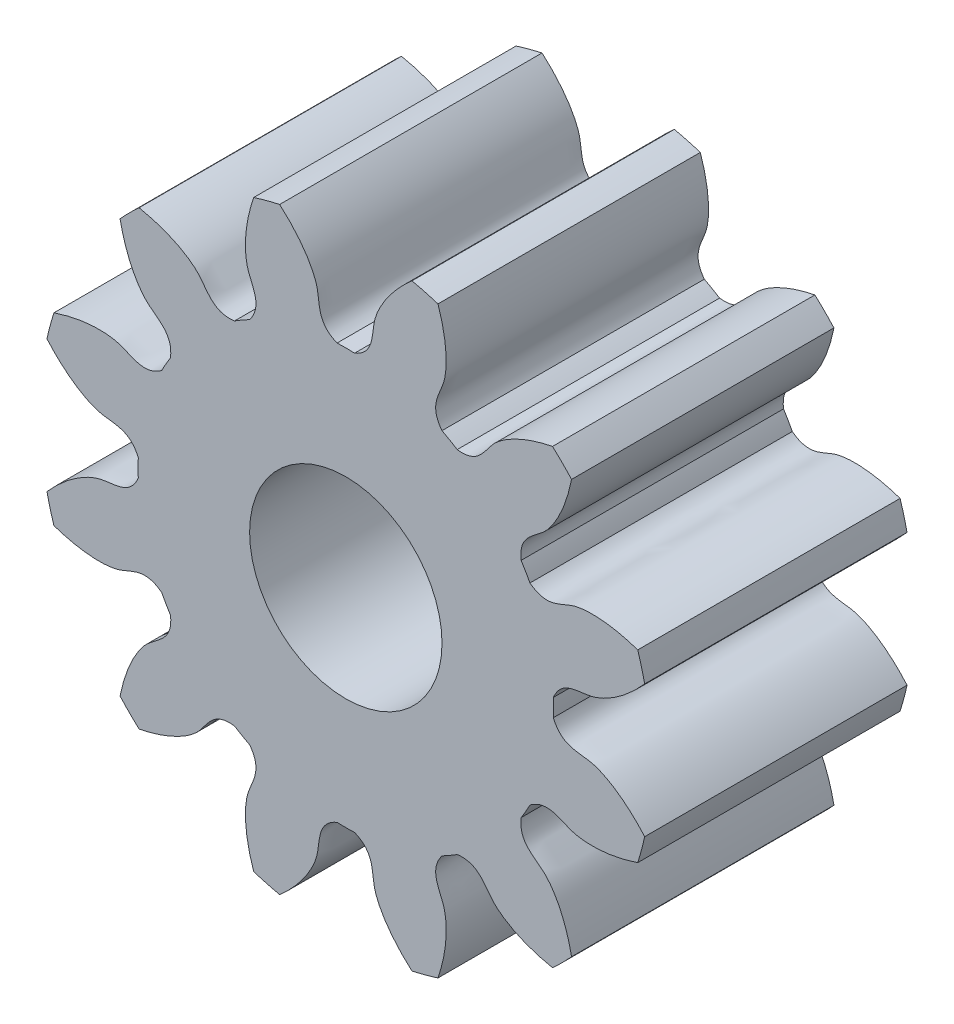
from build123d import *

# Parameters (mm, degrees)
SKETCH_1_R               = 3.5
EXTRUDE_1_DEPTH          = 3
CUT_EXTRUDE_1_DEPTH      = 6.787918451
PATTERN_CIRCULAR_1_COUNT = 12
CUT_EXTRUDE_2_REACH      = 7.688
SKETCH_4_R               = 1.1


with BuildPart() as part:
    # 草图1 → 凸台-拉伸1 (new body)
    with BuildSketch(Plane.XY):
        Circle(SKETCH_1_R)
    extrude(amount=EXTRUDE_1_DEPTH)

    # 草图2 → 切除-拉伸1 (cut, through all)
    with BuildSketch(Plane.XY):
        with BuildLine():
            ThreePointArc((0.100420056, 2.372876063), (0, 2.375), (-0.100420056, 2.372876063))
            add(Edge.make_bspline(
                [(-0.100420056, 2.372876063), (-0.340394435, 2.474653731), (-0.287186739, 2.672409341), (-0.338076094, 2.844740289), (-0.341311927, 2.854952869), (-0.345113625, 2.866166713), (-0.349521434, 2.878363044), (-0.354576313, 2.891521619), (-0.360318258, 2.905621034), (-0.36678678, 2.920638648), (-0.374020716, 2.936550626), (-0.382058239, 2.95333195), (-0.390936819, 2.970956436), (-0.400693193, 2.989396753), (-0.411363332, 3.008624444), (-0.422982412, 3.02860994), (-0.435584786, 3.049322589), (-0.449203949, 3.07073067), (-0.463872517, 3.092801417), (-0.479622192, 3.115501045), (-0.496483738, 3.138794769), (-0.514486952, 3.162646832), (-0.533660639, 3.187020528), (-0.554032585, 3.211878226), (-0.575629533, 3.237181399), (-0.598477155, 3.262890651), (-0.622600033, 3.288965742), (-0.648021632, 3.315365616), (-0.674764279, 3.342048434), (-0.702849139, 3.368971597), (-0.732296196, 3.396091781), (-0.763124233, 3.423364967), (-0.795350811, 3.450746465), (-0.828992247, 3.478190957), (-0.864063604, 3.505652518), (-0.900578664, 3.533084654), (-0.938549918, 3.560440334), (-0.977988547, 3.587672024), (-1.01890441, 3.614731718), (-1.061306025, 3.641570973), (-1.10520056, 3.668140947), (-1.150593819, 3.694392428), (-1.197490231, 3.720275872), (-1.245892835, 3.74574144), (-1.295803277, 3.770739031), (-1.347221796, 3.79521832), (-1.400147219, 3.819128792), (-1.454576948, 3.842419781), (-1.510506963, 3.865040505), (-1.567931802, 3.886940103), (-1.647189853, 3.915363979), (-1.7077968, 3.935050704), (-1.748802701, 3.947485455)],
                knots=[0, 0, 0, 0, 0.218015236, 0.222043642, 0.226545979, 0.231522246, 0.236972443, 0.24289657, 0.249294627, 0.256166614, 0.263512532, 0.271332379, 0.279626157, 0.288393865, 0.297635503, 0.307351072, 0.31754057, 0.328203999, 0.339341357, 0.350952646, 0.363037866, 0.375597015, 0.388630094, 0.402137104, 0.416118043, 0.430572913, 0.445501713, 0.460904444, 0.476781104, 0.493131694, 0.509956215, 0.527254666, 0.545027047, 0.563273358, 0.581993599, 0.601187771, 0.620855872, 0.640997904, 0.661613866, 0.682703758, 0.704267581, 0.726305333, 0.748817015, 0.771802628, 0.795262171, 0.819195644, 0.843603047, 0.868484381, 0.893839644, 0.919668838, 0.945971962, 1, 1, 1, 1], degree=3))
            ThreePointArc((-1.748802701, 3.947485455), (0, 4.317516914), (1.748802701, 3.947485455))
            add(Edge.make_bspline(
                [(0.100420056, 2.372876063), (0.340394435, 2.474653731), (0.287186739, 2.672409341), (0.338076094, 2.844740289), (0.341311927, 2.854952869), (0.345113625, 2.866166713), (0.349521434, 2.878363044), (0.354576313, 2.891521619), (0.360318258, 2.905621034), (0.36678678, 2.920638648), (0.374020716, 2.936550626), (0.382058239, 2.95333195), (0.390936819, 2.970956436), (0.400693193, 2.989396753), (0.411363332, 3.008624444), (0.422982412, 3.02860994), (0.435584786, 3.049322589), (0.449203949, 3.07073067), (0.463872517, 3.092801417), (0.479622192, 3.115501045), (0.496483738, 3.138794769), (0.514486952, 3.162646832), (0.533660639, 3.187020528), (0.554032585, 3.211878226), (0.575629533, 3.237181399), (0.598477155, 3.262890651), (0.622600033, 3.288965742), (0.648021632, 3.315365616), (0.674764279, 3.342048434), (0.702849139, 3.368971597), (0.732296196, 3.396091781), (0.763124233, 3.423364967), (0.795350811, 3.450746465), (0.828992247, 3.478190957), (0.864063604, 3.505652518), (0.900578664, 3.533084654), (0.938549918, 3.560440334), (0.977988547, 3.587672024), (1.01890441, 3.614731718), (1.061306025, 3.641570973), (1.10520056, 3.668140947), (1.150593819, 3.694392428), (1.197490231, 3.720275872), (1.245892835, 3.74574144), (1.295803277, 3.770739031), (1.347221796, 3.79521832), (1.400147219, 3.819128792), (1.454576948, 3.842419781), (1.510506963, 3.865040505), (1.567931802, 3.886940103), (1.647189853, 3.915363979), (1.7077968, 3.935050704), (1.748802701, 3.947485455)],
                knots=[0, 0, 0, 0, 0.218015236, 0.222043642, 0.226545979, 0.231522246, 0.236972443, 0.24289657, 0.249294627, 0.256166614, 0.263512532, 0.271332379, 0.279626157, 0.288393865, 0.297635503, 0.307351072, 0.31754057, 0.328203999, 0.339341357, 0.350952646, 0.363037866, 0.375597015, 0.388630094, 0.402137104, 0.416118043, 0.430572913, 0.445501713, 0.460904444, 0.476781104, 0.493131694, 0.509956215, 0.527254666, 0.545027047, 0.563273358, 0.581993599, 0.601187771, 0.620855872, 0.640997904, 0.661613866, 0.682703758, 0.704267581, 0.726305333, 0.748817015, 0.771802628, 0.795262171, 0.819195644, 0.843603047, 0.868484381, 0.893839644, 0.919668838, 0.945971962, 1, 1, 1, 1], degree=3))
        make_face()
    cut_extrude_1 = extrude(amount=CUT_EXTRUDE_1_DEPTH, mode=Mode.SUBTRACT)

    # 阵列(圆周)1: 切除-拉伸1 ×12 about axis
    pattern_circular_1_axis = Axis((0, 0, 3), (0, 0, -1))
    for i in range(1, PATTERN_CIRCULAR_1_COUNT):
        add(cut_extrude_1.rotate(pattern_circular_1_axis, i * 360 / PATTERN_CIRCULAR_1_COUNT), mode=Mode.SUBTRACT)

    # 草图4 → 切除-拉伸2 (cut, up to next)
    with BuildSketch(Plane.XY.offset(3), mode=Mode.PRIVATE) as cut_extrude_2_sk1:
        Circle(SKETCH_4_R)
    cut_extrude_2_tool1 = extrude(cut_extrude_2_sk1.sketch, amount=-CUT_EXTRUDE_2_REACH, mode=Mode.PRIVATE) & part.part
    add(cut_extrude_2_tool1.solids().sort_by_distance((0, 0, 3))[0], mode=Mode.SUBTRACT)


solid = part.part
